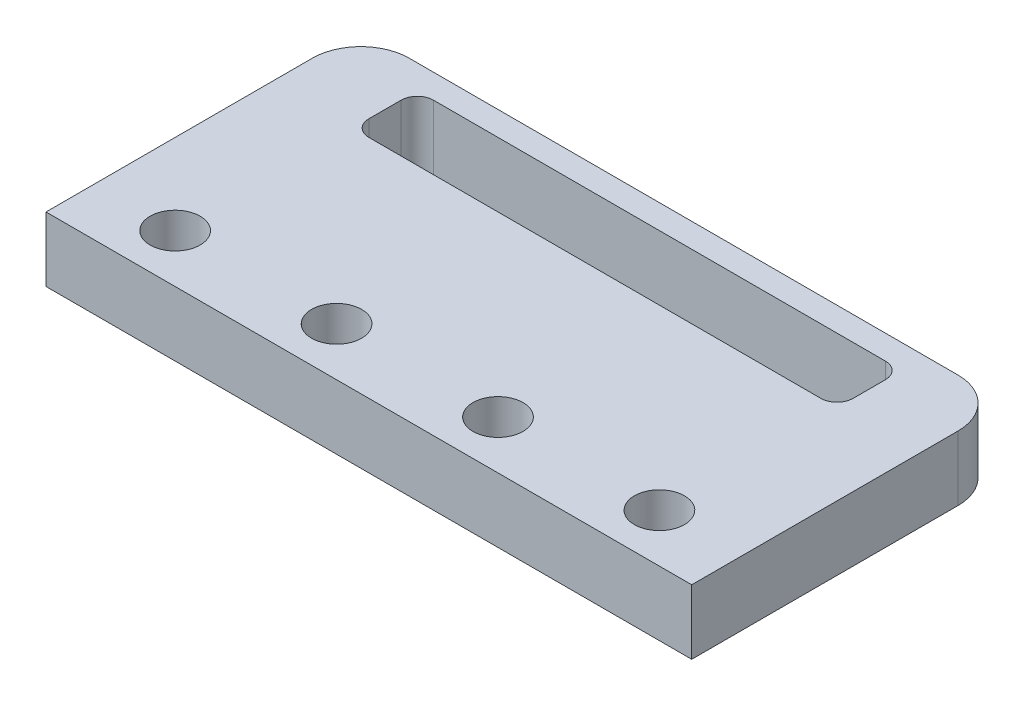
from build123d import *

# Parameters (mm, degrees)
SKETCH_1_W          = 40
SKETCH_1_H          = 19.5
SKETCH_1_R          = 1.55
EXTRUDE_1_DEPTH     = 4
CUT_EXTRUDE_1_DEPTH = 4
FILLET_1_R          = 3


with BuildPart() as part:
    # 草图1 → 凸台-拉伸1 (new body)
    with BuildSketch(Plane(origin=(0, 0, 0), x_dir=(1, 0, 0), z_dir=(0, 1, 0))):
        Rectangle(SKETCH_1_W, SKETCH_1_H)
        with Locations(Location((-15, -6.75, 0), (0, 0, 270))):
            Circle(SKETCH_1_R, mode=Mode.SUBTRACT)
        with Locations(Location((-5, -6.75, 0), (0, 0, 270))):
            Circle(SKETCH_1_R, mode=Mode.SUBTRACT)
        with Locations(Location((15, -6.75, 0), (0, 0, 90))):
            Circle(SKETCH_1_R, mode=Mode.SUBTRACT)
        with Locations(Location((5, -6.75, 0), (0, 0, 90))):
            Circle(SKETCH_1_R, mode=Mode.SUBTRACT)
    extrude(amount=EXTRUDE_1_DEPTH)

    # 草图2 → 切除-拉伸1 (cut)
    with BuildSketch(Plane(origin=(0, 4, 0), x_dir=(1, 0, 0), z_dir=(0, 1, 0))):
        with BuildLine():
            Line((-14, 4.25), (14, 4.25))
            ThreePointArc((14, 4.25), (14.707106781, 4.542893219), (15, 5.25))
            Line((15, 5.25), (15, 7.25))
            ThreePointArc((15, 7.25), (14.707106781, 7.957106781), (14, 8.25))
            Line((14, 8.25), (-14, 8.25))
            ThreePointArc((-14, 8.25), (-14.707106781, 7.957106781), (-15, 7.25))
            Line((-15, 7.25), (-15, 5.25))
            ThreePointArc((-15, 5.25), (-14.707106781, 4.542893219), (-14, 4.25))
        make_face()
    extrude(amount=-CUT_EXTRUDE_1_DEPTH, mode=Mode.SUBTRACT)

    # 圆角1
    fillet_1_edges = [part.edges().sort_by_distance(p)[0] for p in [
        (-20, 2, -9.75),
        (20, 2, -9.75),
    ]]
    fillet(fillet_1_edges, radius=FILLET_1_R)


solid = part.part
